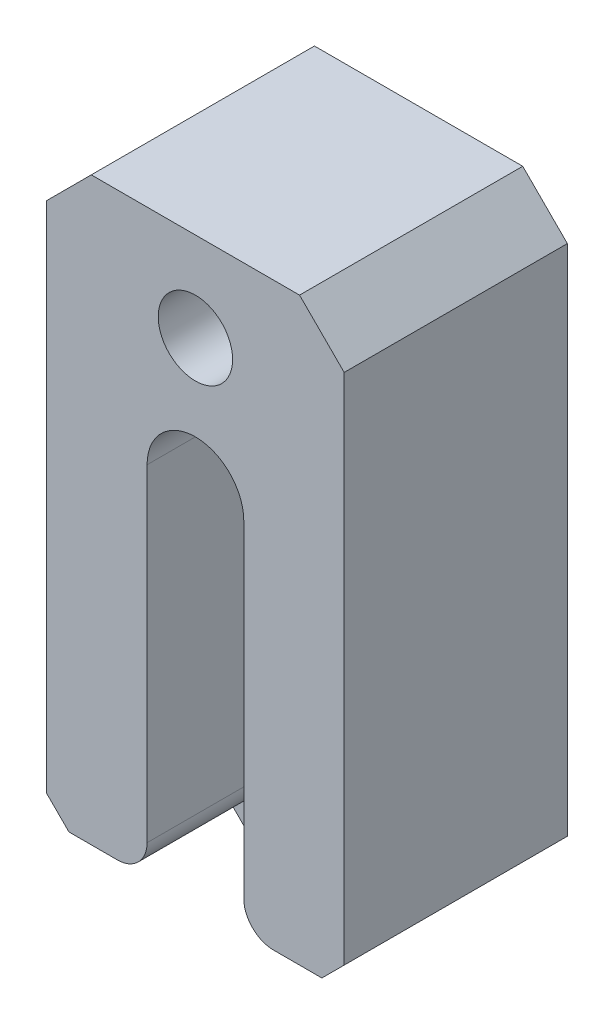
from build123d import *

# Parameters (mm, degrees)
ESQUISSE1_W             = 20
ESQUISSE1_H             = 45
BOSS_EXTRU_1_DEPTH      = 15
ESQUISSE2_R             = 2.5
ENL_V_MAT_EXTRU_1_DEPTH = 15
ESQUISSE3_W             = 20
ESQUISSE3_H             = 6
ENL_V_MAT_EXTRU_2_DEPTH = 9
ENL_V_MAT_EXTRU_3_DEPTH = 15
ESQUISSE7_W             = 6.5
ESQUISSE7_H             = 8
ENL_V_MAT_EXTRU_4_DEPTH = 9
CONG_1_R                = 2
CHANFREIN1_SIZE         = 3


with BuildPart() as part:
    # Esquisse1 → Boss.-Extru.1 (new body)
    with BuildSketch(Plane.XY):
        with Locations((10, 22.5)):
            Rectangle(ESQUISSE1_W, ESQUISSE1_H)
    extrude(amount=BOSS_EXTRU_1_DEPTH)

    # Esquisse2 → Enlèv. mat.-Extru.1 (cut)
    with BuildSketch(Plane.XY.offset(15)):
        with Locations((10, 39)):
            Circle(ESQUISSE2_R)
        with BuildLine():
            Line((6.75, 12), (6.75, 30))
            ThreePointArc((6.75, 30), (10, 33.25), (13.25, 30))
            Line((13.25, 30), (13.25, 12))
            ThreePointArc((13.25, 12), (10, 8.75), (6.75, 12))
        make_face()
    extrude(amount=-ENL_V_MAT_EXTRU_1_DEPTH, mode=Mode.SUBTRACT)

    # Esquisse3 → Enlèv. mat.-Extru.2 (cut)
    with BuildSketch(Plane.XY.offset(15)):
        with Locations((10, 3)):
            Rectangle(ESQUISSE3_W, ESQUISSE3_H)
    extrude(amount=-ENL_V_MAT_EXTRU_2_DEPTH, mode=Mode.SUBTRACT)

    # Esquisse6 → Enlèv. mat.-Extru.3 (cut)
    with BuildSketch(Plane.XY.offset(15)):
        Polygon((7.5, 0), (0, 7.5), (0, -7.5), (20, -7.5), (20, 7.5), (12.5, 0), align=None)
    extrude(amount=-ENL_V_MAT_EXTRU_3_DEPTH, mode=Mode.SUBTRACT)

    # Esquisse7 → Enlèv. mat.-Extru.4 (cut)
    with BuildSketch(Plane.XY.offset(15)):
        with Locations((10, 10)):
            Rectangle(ESQUISSE7_W, ESQUISSE7_H)
    extrude(amount=-ENL_V_MAT_EXTRU_4_DEPTH, mode=Mode.SUBTRACT)

    # Congé1
    cong_1_edges = [part.edges().sort_by_distance(p)[0] for p in [
        (6.75, 6, 10.5),
        (13.25, 6, 10.5),
    ]]
    fillet(cong_1_edges, radius=CONG_1_R)

    # Chanfrein1
    chanfrein1_edges = [part.edges().sort_by_distance(p)[0] for p in [
        (0, 45, 7.5),
        (20, 45, 7.5),
    ]]
    chamfer(chanfrein1_edges, length=CHANFREIN1_SIZE)


solid = part.part
